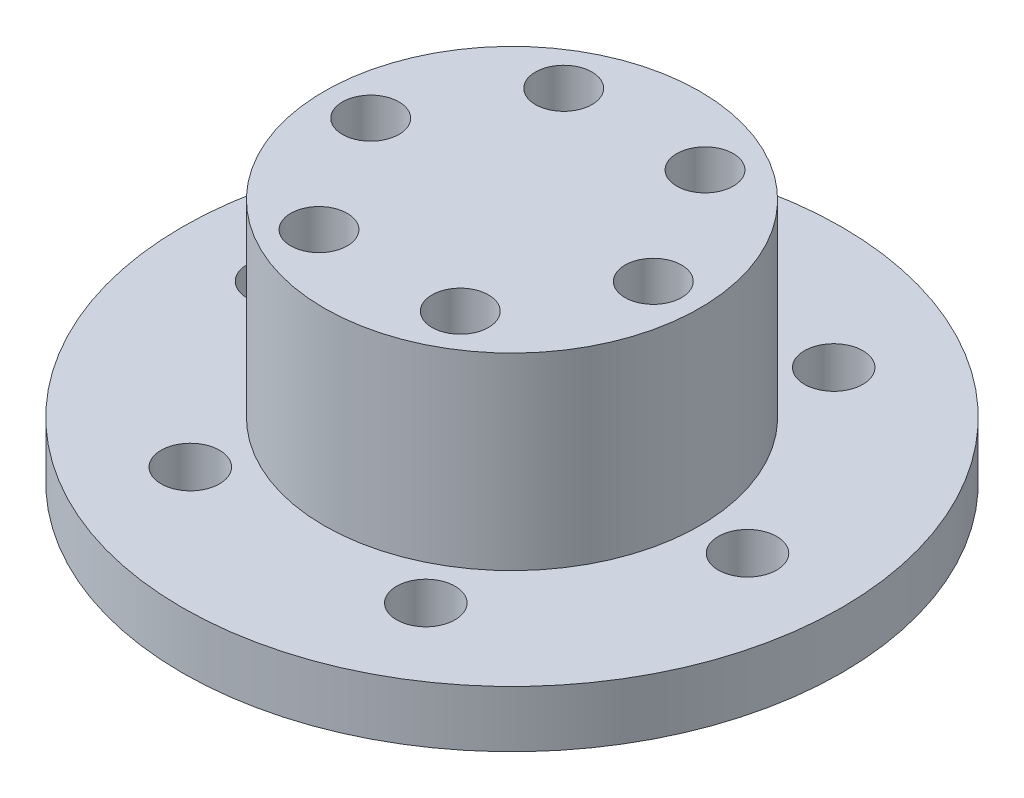
from build123d import *

# Parameters (mm, degrees)
CROQUIS1_R              = 17.5
CROQUIS1_R_2            = 1.55
SALIENTE_EXTRUIR1_DEPTH = 3
CROQUIS2_R              = 9.97
CROQUIS2_R_2            = 1.5
SALIENTE_EXTRUIR2_DEPTH = 10


with BuildPart() as part:
    # Croquis1 → Saliente-Extruir1 (new body)
    with BuildSketch(Plane(origin=(0, 0, 0), x_dir=(1, 0, 0), z_dir=(0, 1, 0))):
        with Locations(Location((0, 0, 0), (0, 0, 270))):
            Circle(CROQUIS1_R)
        with Locations(Location((12.5, 0, 0), (0, 0, 270))):
            Circle(CROQUIS1_R_2, mode=Mode.SUBTRACT)
        with Locations(Location((6.25, -10.825317547, 0), (0, 0, 270))):
            Circle(CROQUIS1_R_2, mode=Mode.SUBTRACT)
        with Locations(Location((-6.25, -10.825317547, 0), (0, 0, 270))):
            Circle(CROQUIS1_R_2, mode=Mode.SUBTRACT)
        with Locations(Location((-12.5, 0, 0), (0, 0, 270))):
            Circle(CROQUIS1_R_2, mode=Mode.SUBTRACT)
        with Locations(Location((-6.25, 10.825317547, 0), (0, 0, 270))):
            Circle(CROQUIS1_R_2, mode=Mode.SUBTRACT)
        with Locations(Location((6.25, 10.825317547, 0), (0, 0, 270))):
            Circle(CROQUIS1_R_2, mode=Mode.SUBTRACT)
    extrude(amount=SALIENTE_EXTRUIR1_DEPTH)

    # Croquis2 → Saliente-Extruir2 (add)
    with BuildSketch(Plane(origin=(0, 3, 0), x_dir=(1, 0, 0), z_dir=(0, 1, 0))):
        with Locations(Location((0, 0, 0), (0, 0, 270))):
            Circle(CROQUIS2_R)
        with Locations(Location((7.5, 0, 0), (0, 0, 270))):
            Circle(CROQUIS2_R_2, mode=Mode.SUBTRACT)
        with Locations(Location((3.75, -6.495190528, 0), (0, 0, 270))):
            Circle(CROQUIS2_R_2, mode=Mode.SUBTRACT)
        with Locations(Location((-3.75, -6.495190528, 0), (0, 0, 270))):
            Circle(CROQUIS2_R_2, mode=Mode.SUBTRACT)
        with Locations(Location((-7.5, 0, 0), (0, 0, 270))):
            Circle(CROQUIS2_R_2, mode=Mode.SUBTRACT)
        with Locations(Location((-3.75, 6.495190528, 0), (0, 0, 270))):
            Circle(CROQUIS2_R_2, mode=Mode.SUBTRACT)
        with Locations(Location((3.75, 6.495190528, 0), (0, 0, 270))):
            Circle(CROQUIS2_R_2, mode=Mode.SUBTRACT)
    extrude(amount=SALIENTE_EXTRUIR2_DEPTH)


solid = part.part
